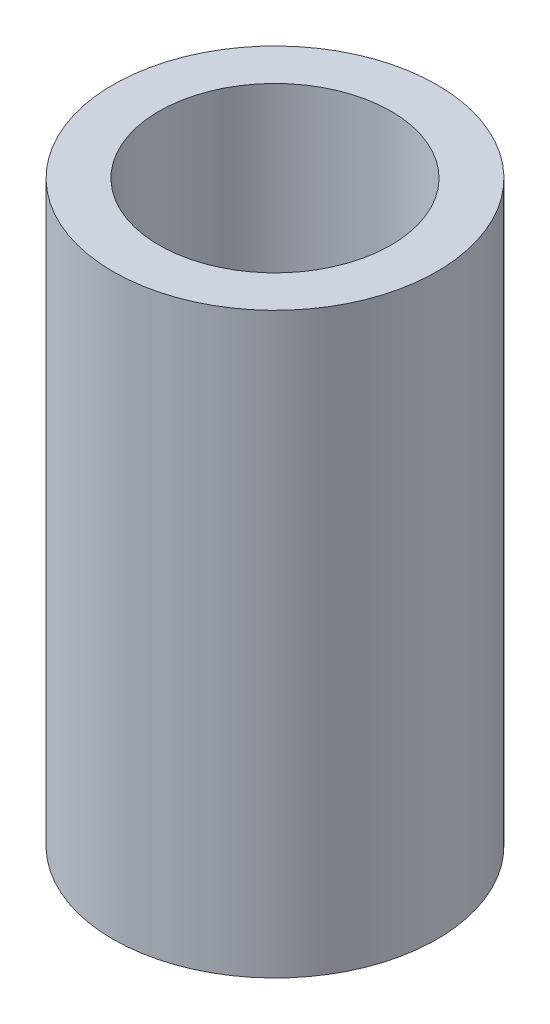
from build123d import *

# Parameters (mm, degrees)
SKETCH1_R           = 10.668
SKETCH1_R_2         = 7.6454
BOSS_EXTRUDE1_DEPTH = 38.1


with BuildPart() as part:
    # Sketch1 → Boss-Extrude1 (new body)
    with BuildSketch(Plane(origin=(0, 0, 0), x_dir=(1, 0, 0), z_dir=(0, 1, 0))):
        with Locations(Location((0, 0, 0), (0, 0, 90))):
            Circle(SKETCH1_R)
        with Locations(Location((0, 0, 0), (0, 0, 90))):
            Circle(SKETCH1_R_2, mode=Mode.SUBTRACT)
    extrude(amount=BOSS_EXTRUDE1_DEPTH)


solid = part.part
